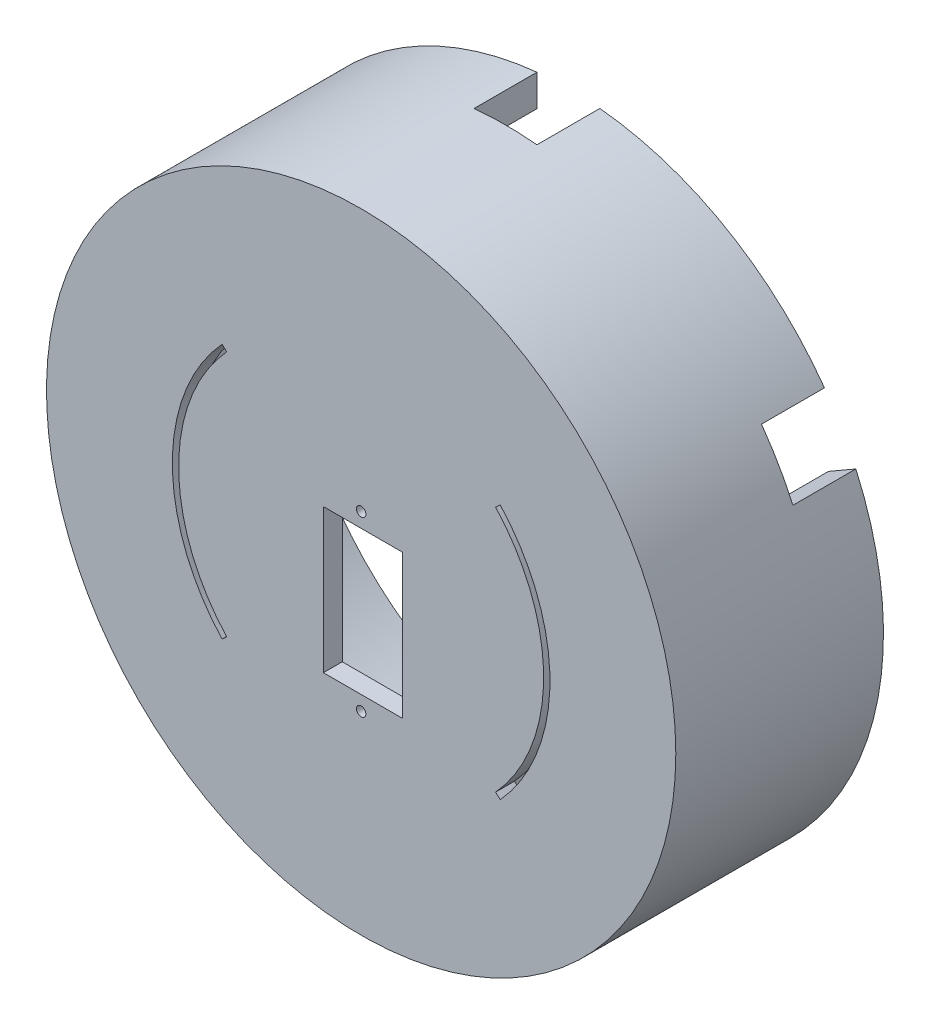
from build123d import *

# Parameters (mm, degrees)
SKETCH1_R           = 50
BOSS_EXTRUDE2_DEPTH = 3
BOSS_EXTRUDE3_START = 30
SKETCH4_R           = 50
SKETCH4_R_2         = 45
BOSS_EXTRUDE3_DEPTH = 30
SKETCH6_W           = 10
SKETCH6_H           = 13.969019588
SKETCH6_H_2         = 16.825930606
CUT_EXTRUDE5_DEPTH  = 10
SKETCH2_R           = 0.75
SKETCH2_W           = 12.6
SKETCH2_H           = 22.86
CUT_EXTRUDE6_DEPTH  = 89.883910805
CUT_EXTRUDE7_DEPTH  = 10


with BuildPart() as part:
    # Sketch1 → Boss-Extrude2 (new body)
    with BuildSketch(Plane.XY):
        with Locations((0.3, 16.86)):
            Circle(SKETCH1_R)
    extrude(amount=BOSS_EXTRUDE2_DEPTH)

    # Sketch4 → Boss-Extrude3 (add)
    with BuildSketch(Plane(origin=(0, 0, 0), x_dir=(-1, 0, 0), z_dir=(0, 0, -1)).offset(BOSS_EXTRUDE3_START)):
        with Locations((-0.3, 16.86)):
            Circle(SKETCH4_R)
        with Locations((-0.3, 16.86)):
            Circle(SKETCH4_R_2, mode=Mode.SUBTRACT)
    extrude(amount=-BOSS_EXTRUDE3_DEPTH)

    # Sketch6 → Cut-Extrude5 (cut)
    with BuildSketch(Plane(origin=(0, 0, -30), x_dir=(-1, 0, 0), z_dir=(0, 0, -1))):
        Polygon((-44.927169294, 48.323775511), (-32.829643465, 41.339265717), (-37.829643465, 32.679011679), (-49.927169294, 39.663521473), align=None)
        with Locations((-0.234844245, -30.535640269)):
            Rectangle(SKETCH6_W, SKETCH6_H)
        Polygon((49.262013539, 39.776374552), (37.164487709, 32.791864758), (32.164487709, 41.452118796), (44.262013539, 48.43662859), align=None)
        with Locations((-0.234844245, 64.462731708)):
            Rectangle(SKETCH6_W, SKETCH6_H_2)
    extrude(amount=-CUT_EXTRUDE5_DEPTH, mode=Mode.SUBTRACT)

    # Sketch2 → Cut-Extrude6 (cut, through all)
    with BuildSketch(Plane(origin=(0, 0, 0), x_dir=(-1, 0, 0), z_dir=(0, 0, -1))):
        with Locations((-0.3, -2.32)):
            Circle(SKETCH2_R)
        with Locations((-0.3, 25.18)):
            Circle(SKETCH2_R)
        with Locations((-0.6, 11.43)):
            Rectangle(SKETCH2_W, SKETCH2_H)
    extrude(amount=-CUT_EXTRUDE6_DEPTH, mode=Mode.SUBTRACT)

    # Sketch7 → Cut-Extrude7 (cut)
    with BuildSketch(Plane.XY.offset(3)):
        with BuildLine():
            Line((-21.802387412, 37.145080002), (-21.065641165, 36.468910669))
            ThreePointArc((-21.065641165, 36.468910669), (-28.7, 16.86), (-21.065641165, -2.748910669))
            Line((-21.065641165, -2.748910669), (-21.802387412, -3.425080002))
            ThreePointArc((-21.802387412, -3.425080002), (-29.7, 16.86), (-21.802387412, 37.145080002))
        make_face()
        with BuildLine():
            Line((21.665641165, -2.748910669), (22.402387412, -3.425080002))
            ThreePointArc((22.402387412, -3.425080002), (30.3, 16.86), (22.402387412, 37.145080002))
            Line((22.402387412, 37.145080002), (21.665641165, 36.468910669))
            ThreePointArc((21.665641165, 36.468910669), (29.3, 16.86), (21.665641165, -2.748910669))
        make_face()
    extrude(amount=-CUT_EXTRUDE7_DEPTH, mode=Mode.SUBTRACT)


solid = part.part
